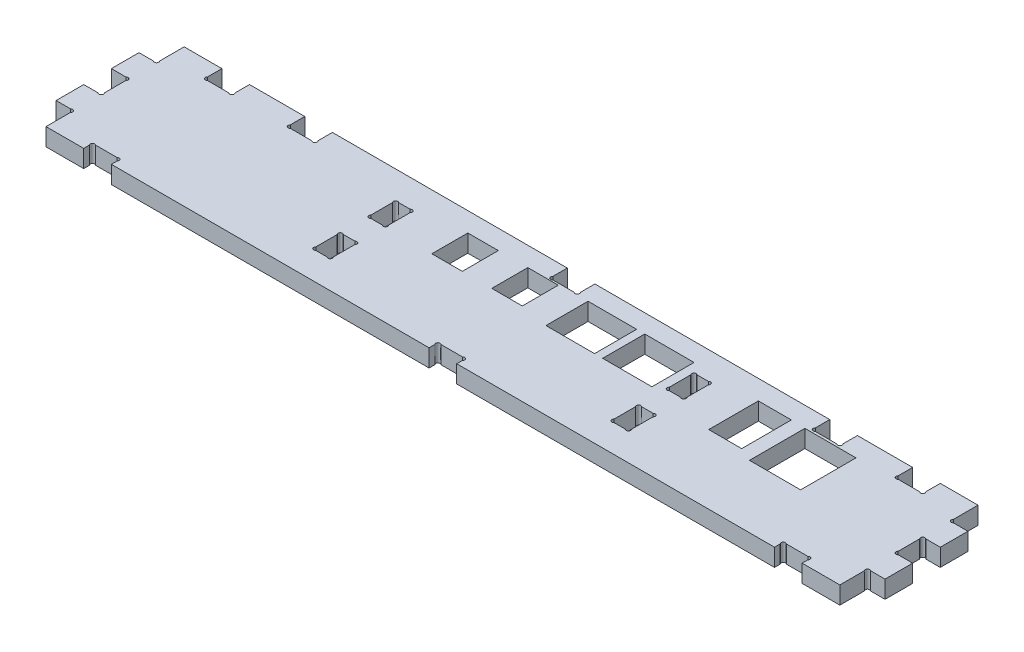
from build123d import *

# Parameters (mm, degrees)
SKETCH1_W           = 11.032
SKETCH1_H           = 13.032
SKETCH1_W_2         = 17.593371491
SKETCH1_H_2         = 15.24
SKETCH1_W_3         = 18.508945301
SKETCH1_H_3         = 20.048591824
SKETCH1_W_4         = 11.938
SKETCH1_H_4         = 17.963703566
SKETCH1_W_5         = 17.84
BOSS_EXTRUDE1_DEPTH = 6.35


with BuildPart() as part:
    # Sketch1 → Boss-Extrude1 (new body)
    with BuildSketch(Plane(origin=(0, 0, 0), x_dir=(1, 0, 0), z_dir=(0, 1, 0))):
        with BuildLine():
            Line((615.95, 18.402467985), (615.95, 9.525))
            Line((615.95, 9.525), (602.3, 9.525))
            Line((602.3, 9.525), (602.3, 11.577467985))
            ThreePointArc((602.3, 11.577467985), (602.3, 12.7), (601.177467985, 12.7))
            Line((601.177467985, 12.7), (593.422532015, 12.7))
            ThreePointArc((593.422532015, 12.7), (592.3, 12.7), (592.3, 11.577467985))
            Line((592.3, 11.577467985), (592.3, 9.525))
            Line((592.3, 9.525), (477.3, 9.525))
            Line((477.3, 9.525), (477.3, 11.577467985))
            ThreePointArc((477.3, 11.577467985), (477.3, 12.7), (476.177467985, 12.7))
            Line((476.177467985, 12.7), (468.422532015, 12.7))
            ThreePointArc((468.422532015, 12.7), (467.3, 12.7), (467.3, 11.577467985))
            Line((467.3, 11.577467985), (467.3, 9.525))
            Line((467.3, 9.525), (352.3, 9.525))
            Line((352.3, 9.525), (352.3, 11.577467985))
            ThreePointArc((352.3, 11.577467985), (352.3, 12.7), (351.177467985, 12.7))
            Line((351.177467985, 12.7), (343.422532015, 12.7))
            ThreePointArc((343.422532015, 12.7), (342.3, 12.7), (342.3, 11.577467985))
            Line((342.3, 11.577467985), (342.3, 9.525))
            Line((342.3, 9.525), (328.65, 9.525))
            Line((328.65, 9.525), (328.65, 18.402467985))
            ThreePointArc((328.65, 18.402467985), (328.65, 19.525), (327.527467985, 19.525))
            Line((327.527467985, 19.525), (322.3, 19.525))
            Line((322.3, 19.525), (322.3, 29.525))
            Line((322.3, 29.525), (327.527467985, 29.525))
            ThreePointArc((327.527467985, 29.525), (328.65, 29.525), (328.65, 30.647532015))
            Line((328.65, 30.647532015), (328.65, 38.402467985))
            ThreePointArc((328.65, 38.402467985), (328.65, 39.525), (327.527467985, 39.525))
            Line((327.527467985, 39.525), (322.3, 39.525))
            Line((322.3, 39.525), (322.3, 49.525))
            Line((322.3, 49.525), (327.527467985, 49.525))
            ThreePointArc((327.527467985, 49.525), (328.65, 49.525), (328.65, 50.647532015))
            Line((328.65, 50.647532015), (328.65, 59.525))
            Line((328.65, 59.525), (342.3, 59.525))
            Line((342.3, 59.525), (342.3, 54.297532015))
            ThreePointArc((342.3, 54.297532015), (342.3, 53.175), (343.422532015, 53.175))
            Line((343.422532015, 53.175), (351.177467985, 53.175))
            ThreePointArc((351.177467985, 53.175), (352.3, 53.175), (352.3, 54.297532015))
            Line((352.3, 54.297532015), (352.3, 59.525))
            Line((352.3, 59.525), (372.3, 59.525))
            Line((372.3, 59.525), (372.3, 54.297532015))
            ThreePointArc((372.3, 54.297532015), (372.3, 53.175), (373.422532015, 53.175))
            Line((373.422532015, 53.175), (381.177467985, 53.175))
            ThreePointArc((381.177467985, 53.175), (382.3, 53.175), (382.3, 54.297532015))
            Line((382.3, 54.297532015), (382.3, 59.525))
            Line((382.3, 59.525), (467.3, 59.525))
            Line((467.3, 59.525), (467.3, 54.297532015))
            ThreePointArc((467.3, 54.297532015), (467.3, 53.175), (468.422532015, 53.175))
            Line((468.422532015, 53.175), (476.177467985, 53.175))
            ThreePointArc((476.177467985, 53.175), (477.3, 53.175), (477.3, 54.297532015))
            Line((477.3, 54.297532015), (477.3, 59.525))
            Line((477.3, 59.525), (562.3, 59.525))
            Line((562.3, 59.525), (562.3, 54.297532015))
            ThreePointArc((562.3, 54.297532015), (562.3, 53.175), (563.422532015, 53.175))
            Line((563.422532015, 53.175), (571.177467985, 53.175))
            ThreePointArc((571.177467985, 53.175), (572.3, 53.175), (572.3, 54.297532015))
            Line((572.3, 54.297532015), (572.3, 59.525))
            Line((572.3, 59.525), (592.3, 59.525))
            Line((592.3, 59.525), (592.3, 54.297532015))
            ThreePointArc((592.3, 54.297532015), (592.3, 53.175), (593.422532015, 53.175))
            Line((593.422532015, 53.175), (601.177467985, 53.175))
            ThreePointArc((601.177467985, 53.175), (602.3, 53.175), (602.3, 54.297532015))
            Line((602.3, 54.297532015), (602.3, 59.525))
            Line((602.3, 59.525), (615.95, 59.525))
            Line((615.95, 59.525), (615.95, 50.647532015))
            ThreePointArc((615.95, 50.647532015), (615.95, 49.525), (617.072532015, 49.525))
            Line((617.072532015, 49.525), (622.3, 49.525))
            Line((622.3, 49.525), (622.3, 39.525))
            Line((622.3, 39.525), (617.072532015, 39.525))
            ThreePointArc((617.072532015, 39.525), (615.95, 39.525), (615.95, 38.402467985))
            Line((615.95, 38.402467985), (615.95, 30.647532015))
            ThreePointArc((615.95, 30.647532015), (615.95, 29.525), (617.072532015, 29.525))
            Line((617.072532015, 29.525), (622.3, 29.525))
            Line((622.3, 29.525), (622.3, 19.525))
            Line((622.3, 19.525), (617.072532015, 19.525))
            ThreePointArc((617.072532015, 19.525), (615.95, 19.525), (615.95, 18.402467985))
        make_face()
        with BuildLine():
            Line((421.513000185, 20.647532015), (421.513000185, 28.402467985))
            ThreePointArc((421.513000185, 28.402467985), (421.513000185, 29.525), (420.39046817, 29.525))
            Line((420.39046817, 29.525), (416.285532201, 29.525))
            ThreePointArc((416.285532201, 29.525), (415.163000185, 29.525), (415.163000185, 28.402467985))
            Line((415.163000185, 28.402467985), (415.163000185, 20.647532015))
            ThreePointArc((415.163000185, 20.647532015), (415.163000185, 19.525), (416.285532201, 19.525))
            Line((416.285532201, 19.525), (420.39046817, 19.525))
            ThreePointArc((420.39046817, 19.525), (421.513000185, 19.525), (421.513000185, 20.647532015))
        make_face(mode=Mode.SUBTRACT)
        with BuildLine():
            Line((421.513000185, 40.647532015), (421.513000185, 48.402467985))
            ThreePointArc((421.513000185, 48.402467985), (421.513000185, 49.525), (420.39046817, 49.525))
            Line((420.39046817, 49.525), (416.285532201, 49.525))
            ThreePointArc((416.285532201, 49.525), (415.163000185, 49.525), (415.163000185, 48.402467985))
            Line((415.163000185, 48.402467985), (415.163000185, 40.647532015))
            ThreePointArc((415.163000185, 40.647532015), (415.163000185, 39.525), (416.285532201, 39.525))
            Line((416.285532201, 39.525), (420.39046817, 39.525))
            ThreePointArc((420.39046817, 39.525), (421.513000185, 39.525), (421.513000185, 40.647532015))
        make_face(mode=Mode.SUBTRACT)
        with BuildLine():
            Line((529.463002139, 20.647532015), (529.463002139, 28.402467985))
            ThreePointArc((529.463002139, 28.402467985), (529.463002139, 29.525), (528.340470124, 29.525))
            Line((528.340470124, 29.525), (524.235534154, 29.525))
            ThreePointArc((524.235534154, 29.525), (523.113002139, 29.525), (523.113002139, 28.402467985))
            Line((523.113002139, 28.402467985), (523.113002139, 20.647532015))
            ThreePointArc((523.113002139, 20.647532015), (523.113002139, 19.525), (524.235534154, 19.525))
            Line((524.235534154, 19.525), (528.340470124, 19.525))
            ThreePointArc((528.340470124, 19.525), (529.463002139, 19.525), (529.463002139, 20.647532015))
        make_face(mode=Mode.SUBTRACT)
        with BuildLine():
            Line((529.463002139, 40.647532015), (529.463002139, 48.402467985))
            ThreePointArc((529.463002139, 48.402467985), (529.463002139, 49.525), (528.340470124, 49.525))
            Line((528.340470124, 49.525), (524.235534154, 49.525))
            ThreePointArc((524.235534154, 49.525), (523.113002139, 49.525), (523.113002139, 48.402467985))
            Line((523.113002139, 48.402467985), (523.113002139, 40.647532015))
            ThreePointArc((523.113002139, 40.647532015), (523.113002139, 39.525), (524.235534154, 39.525))
            Line((524.235534154, 39.525), (528.340470124, 39.525))
            ThreePointArc((528.340470124, 39.525), (529.463002139, 39.525), (529.463002139, 40.647532015))
        make_face(mode=Mode.SUBTRACT)
        with Locations((443.842571078, 46.0002)):
            Rectangle(SKETCH1_W, SKETCH1_H, mode=Mode.SUBTRACT)
        with Locations((465.542571078, 46.0002)):
            Rectangle(SKETCH1_W, SKETCH1_H, mode=Mode.SUBTRACT)
        with Locations((490.269256824, 45.2502)):
            Rectangle(SKETCH1_W_2, SKETCH1_H_2, mode=Mode.SUBTRACT)
        with Locations((569.800096777, 42.243743507)):
            Rectangle(SKETCH1_W_3, SKETCH1_H_3, mode=Mode.SUBTRACT)
        with Locations((549.496624126, 43.468041041)):
            Rectangle(SKETCH1_W_4, SKETCH1_H_4, mode=Mode.SUBTRACT)
        with Locations((510.918448478, 45.2502)):
            Rectangle(SKETCH1_W_5, SKETCH1_H_2, mode=Mode.SUBTRACT)
    extrude(amount=BOSS_EXTRUDE1_DEPTH)


solid = part.part
